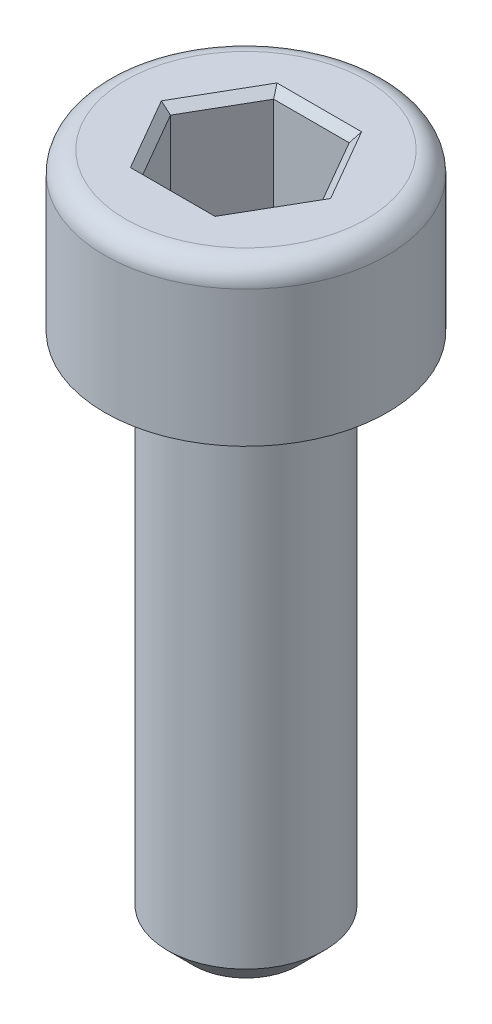
from build123d import *

# Parameters (mm, degrees)
ENL_V_MAT_EXTRU_1_DEPTH = 2
CHANFREIN1_SIZE         = 0.15


with BuildPart() as part:
    # Esquisse1 → Révolution1 (revolve)
    with BuildSketch(Plane.XY, mode=Mode.PRIVATE) as r_volution1_sk:
        with BuildLine():
            Line((1.5, -9.5), (1, -10))
            Line((1, -10), (0, -10))
            Line((0, -10), (0, 3))
            Line((0, 3), (2.3, 3))
            ThreePointArc((2.3, 3), (2.582842712, 2.882842712), (2.7, 2.6))
            Line((2.7, 2.6), (2.7, 0))
            Line((2.7, 0), (1.5, 0))
            Line((1.5, 0), (1.5, -9.5))
        make_face()
    revolve(r_volution1_sk.sketch.rotate(Axis((0, 6.972972973, 0), (0, -1, 0)), 90), axis=Axis((0, 6.972972973, 0), (0, -1, 0)))

    # Esquisse2 → Enlèv. mat.-Extru.1 (cut)
    with BuildSketch(Plane(origin=(0, 3, 0), x_dir=(1, 0, 0), z_dir=(0, 1, 0))):
        Polygon((-1.443375673, 0), (-0.721687836, -1.25), (0.721687836, -1.25), (1.443375673, 0), (0.721687836, 1.25), (-0.721687836, 1.25), align=None)
    extrude(amount=-ENL_V_MAT_EXTRU_1_DEPTH, mode=Mode.SUBTRACT)

    # Chanfrein1
    chanfrein1_edges = [part.edges().sort_by_distance(p)[0] for p in [
        (-1.082531755, 3, -0.625),
        (-1.082531755, 3, 0.625),
        (0, 3, 1.25),
        (1.082531755, 3, 0.625),
        (1.082531755, 3, -0.625),
        (0, 3, -1.25),
    ]]
    chamfer(chanfrein1_edges, length=CHANFREIN1_SIZE)


solid = part.part
